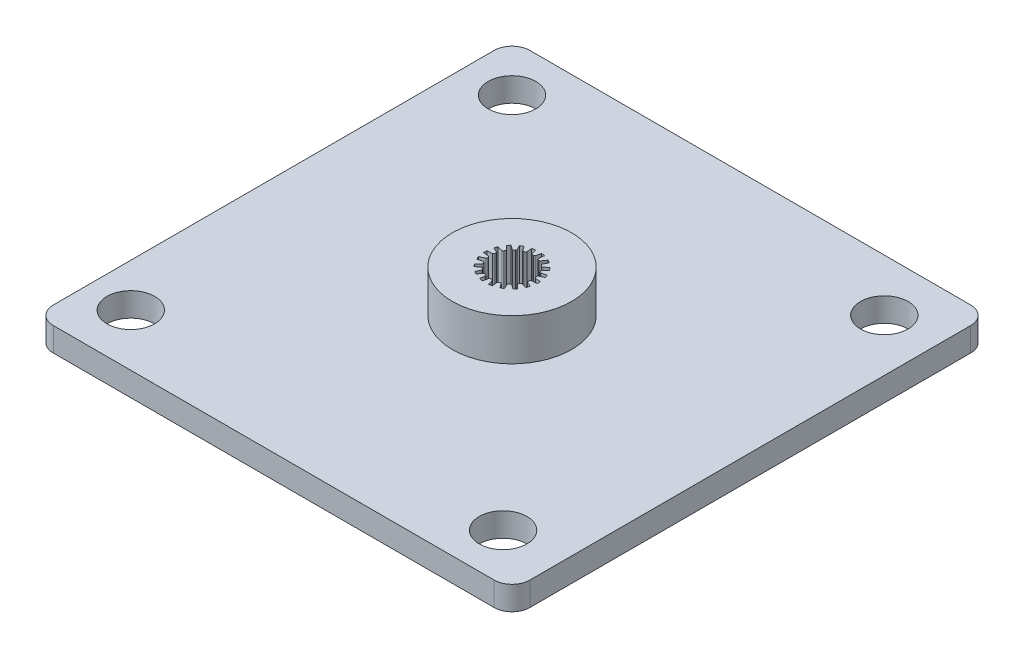
from build123d import *

# Parameters (mm, degrees)
SKETCH1_W           = 40
SKETCH1_H           = 40
SKETCH1_R           = 2
BOSS_EXTRUDE1_DEPTH = 2
FILLET1_R           = 1.5
SKETCH2_R           = 5
BOSS_EXTRUDE2_DEPTH = 3.5
CUT_EXTRUDE4_DEPTH  = 3


with BuildPart() as part:
    # Sketch1 → Boss-Extrude1 (new body)
    with BuildSketch(Plane(origin=(0, 0, 0), x_dir=(1, 0, 0), z_dir=(0, 1, 0))):
        Rectangle(SKETCH1_W, SKETCH1_H)
        with Locations(Location((-16, 16, 0), (0, 0, 270))):
            Circle(SKETCH1_R, mode=Mode.SUBTRACT)
        with Locations(Location((15.626061841, 15.626061841, 0), (0, 0, 270))):
            Circle(SKETCH1_R, mode=Mode.SUBTRACT)
        with Locations(Location((15.252123682, -16, 0), (0, 0, 270))):
            Circle(SKETCH1_R, mode=Mode.SUBTRACT)
        with Locations(Location((-16.373938159, -15.626061841, 0), (0, 0, 270))):
            Circle(SKETCH1_R, mode=Mode.SUBTRACT)
    extrude(amount=BOSS_EXTRUDE1_DEPTH)

    # Fillet1
    fillet1_edges = [part.edges().sort_by_distance(p)[0] for p in [
        (20, 1, 20),
        (-20, 1, 20),
        (-20, 1, -20),
        (20, 1, -20),
    ]]
    fillet(fillet1_edges, radius=FILLET1_R)

    # Sketch2 → Boss-Extrude2 (add)
    with BuildSketch(Plane(origin=(0, 2, 0), x_dir=(1, 0, 0), z_dir=(0, 1, 0))):
        with Locations(Location((0, 0, 0), (0, 0, 270))):
            Circle(SKETCH2_R)
    extrude(amount=BOSS_EXTRUDE2_DEPTH)

    # Sketch4 → Cut-Extrude4 (cut)
    with BuildSketch(Plane(origin=(0, 5.5, 0), x_dir=(1, 0, 0), z_dir=(0, 1, 0))):
        with BuildLine():
            Line((0.25, 2.236067977), (0.145168461, 1.824677172))
            ThreePointArc((0.145168461, 1.824677172), (0.108592246, 1.769616655), (0.045656232, 1.74940433))
            ThreePointArc((0.045656232, 1.74940433), (0, 1.75), (-0.045656232, 1.74940433))
            ThreePointArc((-0.045656232, 1.74940433), (-0.108592246, 1.769616655), (-0.145168461, 1.824677172))
            Line((-0.145168461, 1.824677172), (-0.25, 2.236067977))
            ThreePointArc((-0.25, 2.236067977), (-0.3907084, 2.215817444), (-0.529857135, 2.186721614))
            Line((-0.529857135, 2.186721614), (-0.487662617, 1.764286212))
            ThreePointArc((-0.487662617, 1.764286212), (-0.503201209, 1.700036448), (-0.555428696, 1.65951769))
            ThreePointArc((-0.555428696, 1.65951769), (-0.598535251, 1.644462086), (-0.641234343, 1.628286988))
            ThreePointArc((-0.641234343, 1.628286988), (-0.707287874, 1.625754976), (-0.760490079, 1.664985136))
            Line((-0.760490079, 1.664985136), (-0.999703445, 2.015711542))
            ThreePointArc((-0.999703445, 2.015711542), (-1.125, 1.948557159), (-1.24580568, 1.873624351))
            Line((-1.24580568, 1.873624351), (-1.061674385, 1.491096296))
            ThreePointArc((-1.061674385, 1.491096296), (-1.054301173, 1.425406755), (-1.089520725, 1.369468725))
            ThreePointArc((-1.089520725, 1.369468725), (-1.124878317, 1.340577775), (-1.15947013, 1.310774205))
            ThreePointArc((-1.15947013, 1.310774205), (-1.220674146, 1.285803254), (-1.28408537, 1.30447132))
            Line((-1.28408537, 1.30447132), (-1.628827901, 1.552230546))
            ThreePointArc((-1.628827901, 1.552230546), (-1.723599997, 1.446272122), (-1.811491673, 1.33454034))
            Line((-1.811491673, 1.33454034), (-1.507632554, 1.038058161))
            ThreePointArc((-1.507632554, 1.038058161), (-1.478236855, 0.978851971), (-1.492200475, 0.914241621))
            ThreePointArc((-1.492200475, 0.914241621), (-1.515544457, 0.875), (-1.537856707, 0.835162708))
            ThreePointArc((-1.537856707, 0.835162708), (-1.586829101, 0.790764683), (-1.652801015, 0.786619011))
            Line((-1.652801015, 0.786619011), (-2.061491673, 0.901527638))
            ThreePointArc((-2.061491673, 0.901527638), (-2.114308397, 0.769545322), (-2.158685036, 0.634491068))
            Line((-2.158685036, 0.634491068), (-1.771747987, 0.459814891))
            ThreePointArc((-1.771747987, 0.459814891), (-1.723875356, 0.414233193), (-1.714898826, 0.348743485))
            ThreePointArc((-1.714898826, 0.348743485), (-1.723413568, 0.303884311), (-1.730755068, 0.258818263))
            ThreePointArc((-1.730755068, 0.258818263), (-1.761589047, 0.200348221), (-1.822164464, 0.17388884))
            Line((-1.822164464, 0.17388884), (-2.245509125, 0.142087191))
            ThreePointArc((-2.245509125, 0.142087191), (-2.25, 0), (-2.245509125, -0.142087191))
            Line((-2.245509125, -0.142087191), (-1.822164464, -0.17388884))
            ThreePointArc((-1.822164464, -0.17388884), (-1.761589047, -0.200348221), (-1.730755068, -0.258818263))
            ThreePointArc((-1.730755068, -0.258818263), (-1.723413568, -0.303884311), (-1.714898826, -0.348743485))
            ThreePointArc((-1.714898826, -0.348743485), (-1.723875356, -0.414233193), (-1.771747987, -0.459814891))
            Line((-1.771747987, -0.459814891), (-2.158685036, -0.634491068))
            ThreePointArc((-2.158685036, -0.634491068), (-2.114308397, -0.769545322), (-2.061491673, -0.901527638))
            Line((-2.061491673, -0.901527638), (-1.652801015, -0.786619011))
            ThreePointArc((-1.652801015, -0.786619011), (-1.586829101, -0.790764683), (-1.537856707, -0.835162708))
            ThreePointArc((-1.537856707, -0.835162708), (-1.515544457, -0.875), (-1.492200475, -0.914241621))
            ThreePointArc((-1.492200475, -0.914241621), (-1.478236855, -0.978851971), (-1.507632554, -1.038058161))
            Line((-1.507632554, -1.038058161), (-1.811491673, -1.33454034))
            ThreePointArc((-1.811491673, -1.33454034), (-1.723599997, -1.446272122), (-1.628827901, -1.552230546))
            Line((-1.628827901, -1.552230546), (-1.28408537, -1.30447132))
            ThreePointArc((-1.28408537, -1.30447132), (-1.220674146, -1.285803254), (-1.15947013, -1.310774205))
            ThreePointArc((-1.15947013, -1.310774205), (-1.124878317, -1.340577775), (-1.089520725, -1.369468725))
            ThreePointArc((-1.089520725, -1.369468725), (-1.054301173, -1.425406755), (-1.061674385, -1.491096296))
            Line((-1.061674385, -1.491096296), (-1.24580568, -1.873624351))
            ThreePointArc((-1.24580568, -1.873624351), (-1.125, -1.948557159), (-0.999703445, -2.015711542))
            Line((-0.999703445, -2.015711542), (-0.760490079, -1.664985136))
            ThreePointArc((-0.760490079, -1.664985136), (-0.707287874, -1.625754976), (-0.641234343, -1.628286988))
            ThreePointArc((-0.641234343, -1.628286988), (-0.598535251, -1.644462086), (-0.555428696, -1.65951769))
            ThreePointArc((-0.555428696, -1.65951769), (-0.503201209, -1.700036448), (-0.487662617, -1.764286212))
            Line((-0.487662617, -1.764286212), (-0.529857135, -2.186721614))
            ThreePointArc((-0.529857135, -2.186721614), (-0.3907084, -2.215817444), (-0.25, -2.236067977))
            Line((-0.25, -2.236067977), (-0.145168461, -1.824677172))
            ThreePointArc((-0.145168461, -1.824677172), (-0.108592246, -1.769616655), (-0.045656232, -1.74940433))
            ThreePointArc((-0.045656232, -1.74940433), (0, -1.75), (0.045656232, -1.74940433))
            ThreePointArc((0.045656232, -1.74940433), (0.108592246, -1.769616655), (0.145168461, -1.824677172))
            Line((0.145168461, -1.824677172), (0.25, -2.236067977))
            ThreePointArc((0.25, -2.236067977), (0.3907084, -2.215817444), (0.529857135, -2.186721614))
            Line((0.529857135, -2.186721614), (0.487662617, -1.764286212))
            ThreePointArc((0.487662617, -1.764286212), (0.503201209, -1.700036448), (0.555428696, -1.65951769))
            ThreePointArc((0.555428696, -1.65951769), (0.598535251, -1.644462086), (0.641234343, -1.628286988))
            ThreePointArc((0.641234343, -1.628286988), (0.707287874, -1.625754976), (0.760490079, -1.664985136))
            Line((0.760490079, -1.664985136), (0.999703445, -2.015711542))
            ThreePointArc((0.999703445, -2.015711542), (1.125, -1.948557159), (1.24580568, -1.873624351))
            Line((1.24580568, -1.873624351), (1.061674385, -1.491096296))
            ThreePointArc((1.061674385, -1.491096296), (1.054301173, -1.425406755), (1.089520725, -1.369468725))
            ThreePointArc((1.089520725, -1.369468725), (1.124878317, -1.340577775), (1.15947013, -1.310774205))
            ThreePointArc((1.15947013, -1.310774205), (1.220674146, -1.285803254), (1.28408537, -1.30447132))
            Line((1.28408537, -1.30447132), (1.628827901, -1.552230546))
            ThreePointArc((1.628827901, -1.552230546), (1.723599997, -1.446272122), (1.811491673, -1.33454034))
            Line((1.811491673, -1.33454034), (1.507632554, -1.038058161))
            ThreePointArc((1.507632554, -1.038058161), (1.478236855, -0.978851971), (1.492200475, -0.914241621))
            ThreePointArc((1.492200475, -0.914241621), (1.515544457, -0.875), (1.537856707, -0.835162708))
            ThreePointArc((1.537856707, -0.835162708), (1.586829101, -0.790764683), (1.652801015, -0.786619011))
            Line((1.652801015, -0.786619011), (2.061491673, -0.901527638))
            ThreePointArc((2.061491673, -0.901527638), (2.114308397, -0.769545322), (2.158685036, -0.634491068))
            Line((2.158685036, -0.634491068), (1.771747987, -0.459814891))
            ThreePointArc((1.771747987, -0.459814891), (1.723875356, -0.414233193), (1.714898826, -0.348743485))
            ThreePointArc((1.714898826, -0.348743485), (1.723413568, -0.303884311), (1.730755068, -0.258818263))
            ThreePointArc((1.730755068, -0.258818263), (1.761589047, -0.200348221), (1.822164464, -0.17388884))
            Line((1.822164464, -0.17388884), (2.245509125, -0.142087191))
            ThreePointArc((2.245509125, -0.142087191), (2.25, 0), (2.245509125, 0.142087191))
            Line((2.245509125, 0.142087191), (1.822164464, 0.17388884))
            ThreePointArc((1.822164464, 0.17388884), (1.761589047, 0.200348221), (1.730755068, 0.258818263))
            ThreePointArc((1.730755068, 0.258818263), (1.723413568, 0.303884311), (1.714898826, 0.348743485))
            ThreePointArc((1.714898826, 0.348743485), (1.723875356, 0.414233193), (1.771747987, 0.459814891))
            Line((1.771747987, 0.459814891), (2.158685036, 0.634491068))
            ThreePointArc((2.158685036, 0.634491068), (2.114308397, 0.769545322), (2.061491673, 0.901527638))
            Line((2.061491673, 0.901527638), (1.652801015, 0.786619011))
            ThreePointArc((1.652801015, 0.786619011), (1.586829101, 0.790764683), (1.537856707, 0.835162708))
            ThreePointArc((1.537856707, 0.835162708), (1.515544457, 0.875), (1.492200475, 0.914241621))
            ThreePointArc((1.492200475, 0.914241621), (1.478236855, 0.978851971), (1.507632554, 1.038058161))
            Line((1.507632554, 1.038058161), (1.811491673, 1.33454034))
            ThreePointArc((1.811491673, 1.33454034), (1.723599997, 1.446272122), (1.628827901, 1.552230546))
            Line((1.628827901, 1.552230546), (1.28408537, 1.30447132))
            ThreePointArc((1.28408537, 1.30447132), (1.220674146, 1.285803254), (1.15947013, 1.310774205))
            ThreePointArc((1.15947013, 1.310774205), (1.124878317, 1.340577775), (1.089520725, 1.369468725))
            ThreePointArc((1.089520725, 1.369468725), (1.054301173, 1.425406755), (1.061674385, 1.491096296))
            Line((1.061674385, 1.491096296), (1.24580568, 1.873624351))
            ThreePointArc((1.24580568, 1.873624351), (1.125, 1.948557159), (0.999703445, 2.015711542))
            Line((0.999703445, 2.015711542), (0.760490079, 1.664985136))
            ThreePointArc((0.760490079, 1.664985136), (0.707287874, 1.625754976), (0.641234343, 1.628286988))
            ThreePointArc((0.641234343, 1.628286988), (0.598535251, 1.644462086), (0.555428696, 1.65951769))
            ThreePointArc((0.555428696, 1.65951769), (0.503201209, 1.700036448), (0.487662617, 1.764286212))
            Line((0.487662617, 1.764286212), (0.529857135, 2.186721614))
            ThreePointArc((0.529857135, 2.186721614), (0.3907084, 2.215817444), (0.25, 2.236067977))
        make_face()
    extrude(amount=-CUT_EXTRUDE4_DEPTH, mode=Mode.SUBTRACT)


solid = part.part
